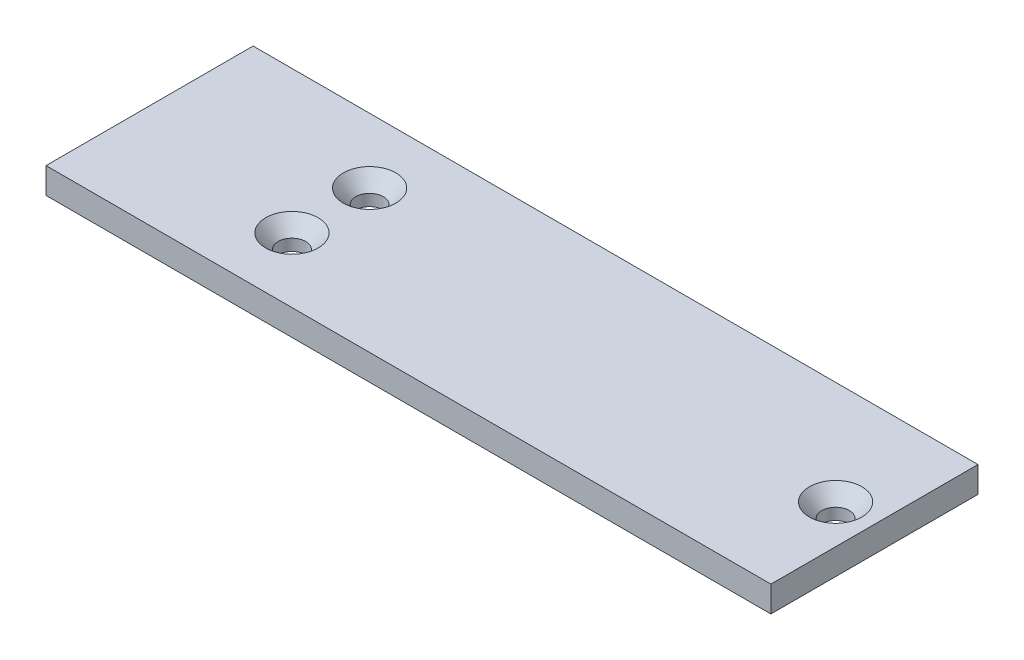
from build123d import *

# Parameters (mm, degrees)
SKETCH1_W                                        = 177.8
SKETCH1_H                                        = 50.8
BOSS_EXTRUDE1_DEPTH                              = 3.175
CSK_FOR_1_4_FLAT_HEAD_MACHINE_SCREW1_D           = 6.7564
CSK_FOR_1_4_FLAT_HEAD_MACHINE_SCREW1_DEPTH       = 19.05
CSK_FOR_1_4_FLAT_HEAD_MACHINE_SCREW1_CSINK_D     = 12.8778
CSK_FOR_1_4_FLAT_HEAD_MACHINE_SCREW1_CSINK_ANGLE = 82
CSK_FOR_1_4_FLAT_HEAD_MACHINE_SCREW1_TIP         = 2.029827343


with BuildPart() as part:
    # Sketch1 → Boss-Extrude1 (new, symmetric)
    with BuildSketch(Plane(origin=(0, 0, 0), x_dir=(1, 0, 0), z_dir=(0, 1, 0))):
        Rectangle(SKETCH1_W, SKETCH1_H)
    extrude(amount=BOSS_EXTRUDE1_DEPTH, both=True)

    # CSK for 1/4 Flat Head Machine Screw1
    with Locations(Plane(origin=(0, 3.175, 0), x_dir=(1, 0, 0), z_dir=(0, 1, 0))):
        with Locations((79.375, 0), (-44.45, 9.525), (-44.45, -9.525)):
            CounterSinkHole(CSK_FOR_1_4_FLAT_HEAD_MACHINE_SCREW1_D / 2, CSK_FOR_1_4_FLAT_HEAD_MACHINE_SCREW1_CSINK_D / 2, depth=CSK_FOR_1_4_FLAT_HEAD_MACHINE_SCREW1_DEPTH, counter_sink_angle=CSK_FOR_1_4_FLAT_HEAD_MACHINE_SCREW1_CSINK_ANGLE)
            with Locations((0, 0, -(CSK_FOR_1_4_FLAT_HEAD_MACHINE_SCREW1_DEPTH + CSK_FOR_1_4_FLAT_HEAD_MACHINE_SCREW1_TIP / 2))):  # 118° drill point
                Cone(0, CSK_FOR_1_4_FLAT_HEAD_MACHINE_SCREW1_D / 2, CSK_FOR_1_4_FLAT_HEAD_MACHINE_SCREW1_TIP, mode=Mode.SUBTRACT)


solid = part.part
